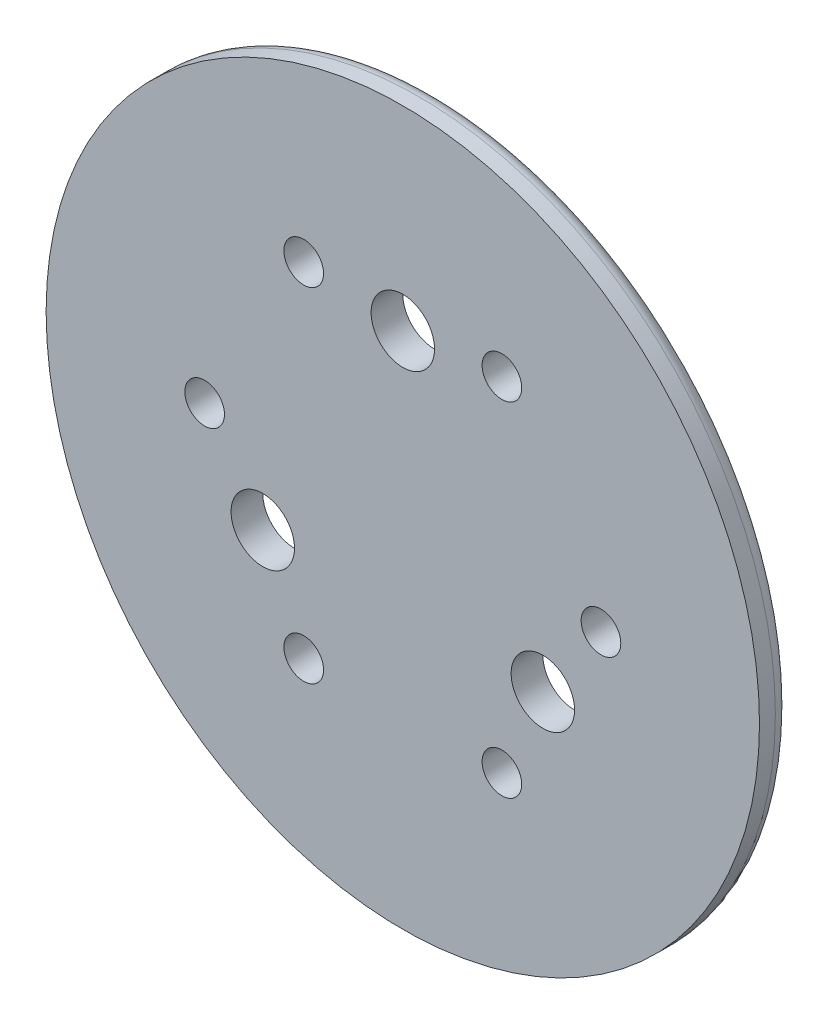
from build123d import *

# Parameters (mm, degrees)
SKETCH_1_R      = 22.5
SKETCH_1_R_2    = 2
SKETCH_1_R_3    = 1.25
EXTRUDE_1_DEPTH = 2
FILLET_1_R      = 1


with BuildPart() as part:
    # 草图1 → 凸台-拉伸1 (new body)
    with BuildSketch(Plane.XY):
        Circle(SKETCH_1_R)
        with Locations((0, 10.2)):
            Circle(SKETCH_1_R_2, mode=Mode.SUBTRACT)
        with Locations((-6.25, 10.825317547)):
            Circle(SKETCH_1_R_3, mode=Mode.SUBTRACT)
        with Locations((6.25, 10.825317547)):
            Circle(SKETCH_1_R_3, mode=Mode.SUBTRACT)
        with Locations((12.5, 0)):
            Circle(SKETCH_1_R_3, mode=Mode.SUBTRACT)
        with Locations((6.25, -10.825317547)):
            Circle(SKETCH_1_R_3, mode=Mode.SUBTRACT)
        with Locations((-6.25, -10.825317547)):
            Circle(SKETCH_1_R_3, mode=Mode.SUBTRACT)
        with Locations((-12.5, 0)):
            Circle(SKETCH_1_R_3, mode=Mode.SUBTRACT)
        with Locations((-8.833459119, -5.1)):
            Circle(SKETCH_1_R_2, mode=Mode.SUBTRACT)
        with Locations((8.833459119, -5.1)):
            Circle(SKETCH_1_R_2, mode=Mode.SUBTRACT)
    extrude(amount=EXTRUDE_1_DEPTH)

    # 圆角1
    fillet_1_edges = [part.edges().sort_by_distance(p)[0] for p in [
        (-22.5, 0, 0),
    ]]
    fillet(fillet_1_edges, radius=FILLET_1_R)


solid = part.part
